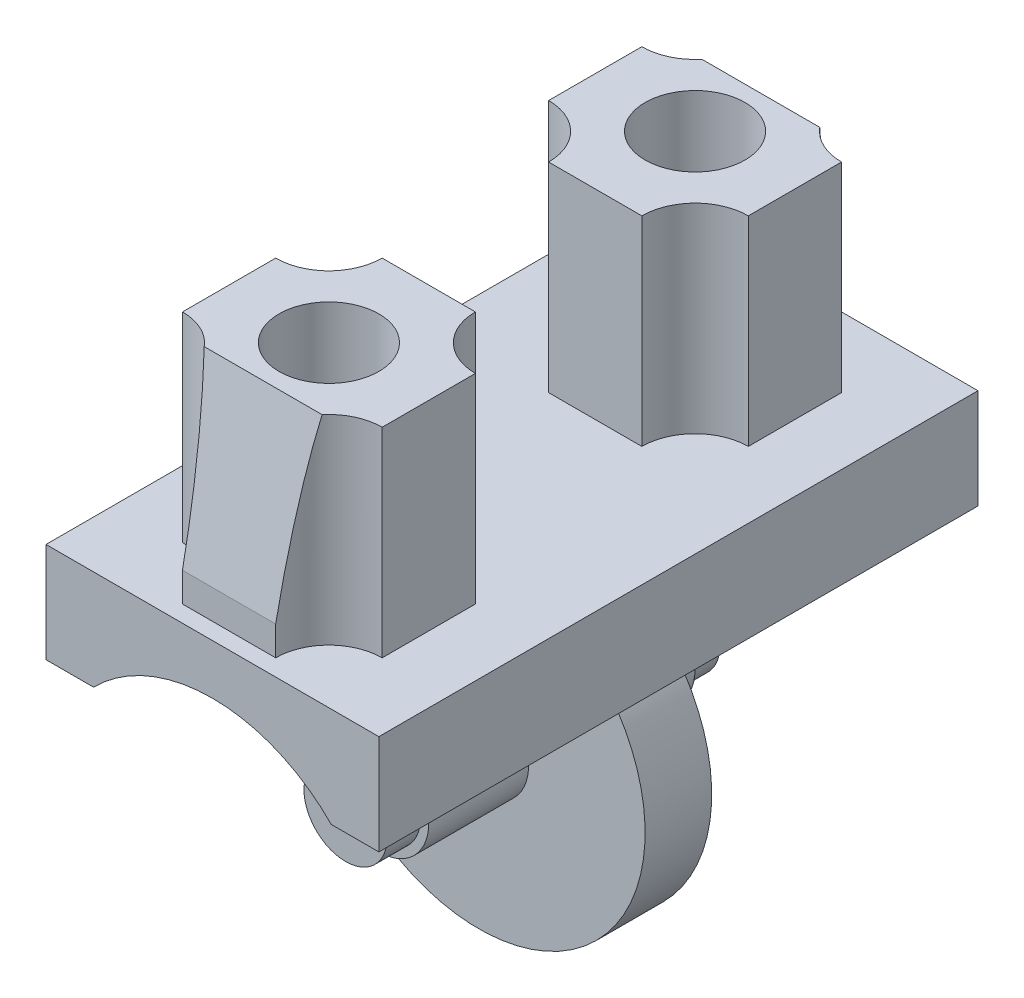
from build123d import *

# Parameters (mm, degrees)
SKETCH1_W           = 7.9375
SKETCH1_H           = 2.38125
BOSS_EXTRUDE1_DEPTH = 7.14375
SKETCH2_R           = 3.96875
BOSS_EXTRUDE2_DEPTH = 0.79375
SKETCH3_R           = 3.96875
CUT_EXTRUDE1_DEPTH  = 14.661957117
SKETCH4_W           = 4.7625
SKETCH4_H           = 4.7625
BOSS_EXTRUDE3_DEPTH = 4.7625
SKETCH5_R           = 1.27
SKETCH5_R_2         = 1.190625
CUT_EXTRUDE2_DEPTH  = 4.7625
CUT_EXTRUDE3_DEPTH  = 14.216592983
SKETCH7_R           = 1.190625
BOSS_EXTRUDE4_DEPTH = 2.38125
SKETCH8_R           = 0.9921875
BOSS_EXTRUDE5_DEPTH = 0.79375
SKETCH9_W           = 2.032
SKETCH9_H           = 0.79375
CUT_EXTRUDE4_DEPTH  = 0.79375


with BuildPart() as part:
    # Sketch1 → Boss-Extrude1 (new body)
    with BuildSketch(Plane.XY):
        with Locations((3.96875, -1.190625)):
            Rectangle(SKETCH1_W, SKETCH1_H)
    boss_extrude1 = extrude(amount=BOSS_EXTRUDE1_DEPTH)

    # Sketch2 → Boss-Extrude2 (add)
    with BuildSketch(Plane(origin=(0, 0, 0), x_dir=(-1, 0, 0), z_dir=(0, 0, -1))):
        with Locations((-3.96875, -5.159375)):
            Circle(SKETCH2_R)
    boss_extrude2 = extrude(amount=-BOSS_EXTRUDE2_DEPTH)

    # Sketch3 → Cut-Extrude1 (cut, through all)
    with BuildSketch(Plane.XY.offset(0.79375)):
        with Locations((3.96875, -5.159375)):
            Circle(SKETCH3_R)
    cut_extrude1 = extrude(amount=CUT_EXTRUDE1_DEPTH, mode=Mode.SUBTRACT)

    # Sketch4 → Boss-Extrude3 (add)
    with BuildSketch(Plane(origin=(0, 0, 0), x_dir=(1, 0, 0), z_dir=(0, 1, 0))):
        with Locations((3.96875, -4.365625)):
            Rectangle(SKETCH4_W, SKETCH4_H)
    boss_extrude3 = extrude(amount=BOSS_EXTRUDE3_DEPTH)

    # Sketch5 → Cut-Extrude2 (cut)
    with BuildSketch(Plane(origin=(0, 4.7625, 0), x_dir=(1, 0, 0), z_dir=(0, 1, 0))):
        with Locations((1.5875, -6.746875)):
            Circle(SKETCH5_R)
        with Locations((1.5875, -1.984375)):
            Circle(SKETCH5_R)
        with Locations((6.35, -1.984375)):
            Circle(SKETCH5_R)
        with Locations((6.35, -6.746875)):
            Circle(SKETCH5_R)
        with Locations(Location((3.96875, -4.365625, 0), (0, 0, 270))):
            Circle(SKETCH5_R_2)
    cut_extrude2 = extrude(amount=-CUT_EXTRUDE2_DEPTH, mode=Mode.SUBTRACT)

    # Sketch6 → Cut-Extrude3 (cut, through all)
    with BuildSketch(Plane.ZY.offset(-1.5875)):
        Polygon((6.746875, 0.6985), (6.746875, 5.7785), (5.730875, 5.7785), align=None)
    cut_extrude3 = extrude(amount=-CUT_EXTRUDE3_DEPTH, mode=Mode.SUBTRACT)

    # Sketch7 → Boss-Extrude4 (add)
    with BuildSketch(Plane.XY.offset(0.79375)):
        with Locations(Location((3.96875, -5.159375, 0), (0, 0, 180))):
            Circle(SKETCH7_R)
    boss_extrude4 = extrude(amount=BOSS_EXTRUDE4_DEPTH)

    # Sketch8 → Boss-Extrude5 (add)
    with BuildSketch(Plane.XY.offset(3.175)):
        with Locations((3.96875, -5.159375)):
            Circle(SKETCH8_R)
    boss_extrude5 = extrude(amount=BOSS_EXTRUDE5_DEPTH)

    # Sketch9 → Cut-Extrude4 (cut)
    with BuildSketch(Plane.XY.offset(3.96875)):
        with Locations((3.96875, -4.365625)):
            Rectangle(SKETCH9_W, SKETCH9_H)
    cut_extrude4 = extrude(amount=-CUT_EXTRUDE4_DEPTH, mode=Mode.SUBTRACT)

    # Mirror1: Boss-Extrude1, Boss-Extrude2, Cut-Extrude1, Boss-Extrude3, Cut-Extrude2, Cut-Extrude3, Boss-Extrude4, Boss-Extrude5, Cut-Extrude4 across plane
    add(boss_extrude1.mirror(Plane.XY))
    add(boss_extrude2.mirror(Plane.XY))
    add(cut_extrude1.mirror(Plane.XY), mode=Mode.SUBTRACT)
    add(boss_extrude3.mirror(Plane.XY))
    add(cut_extrude2.mirror(Plane.XY), mode=Mode.SUBTRACT)
    add(cut_extrude3.mirror(Plane.XY), mode=Mode.SUBTRACT)
    add(boss_extrude4.mirror(Plane.XY))
    add(boss_extrude5.mirror(Plane.XY))
    add(cut_extrude4.mirror(Plane.XY), mode=Mode.SUBTRACT)


solid = part.part
